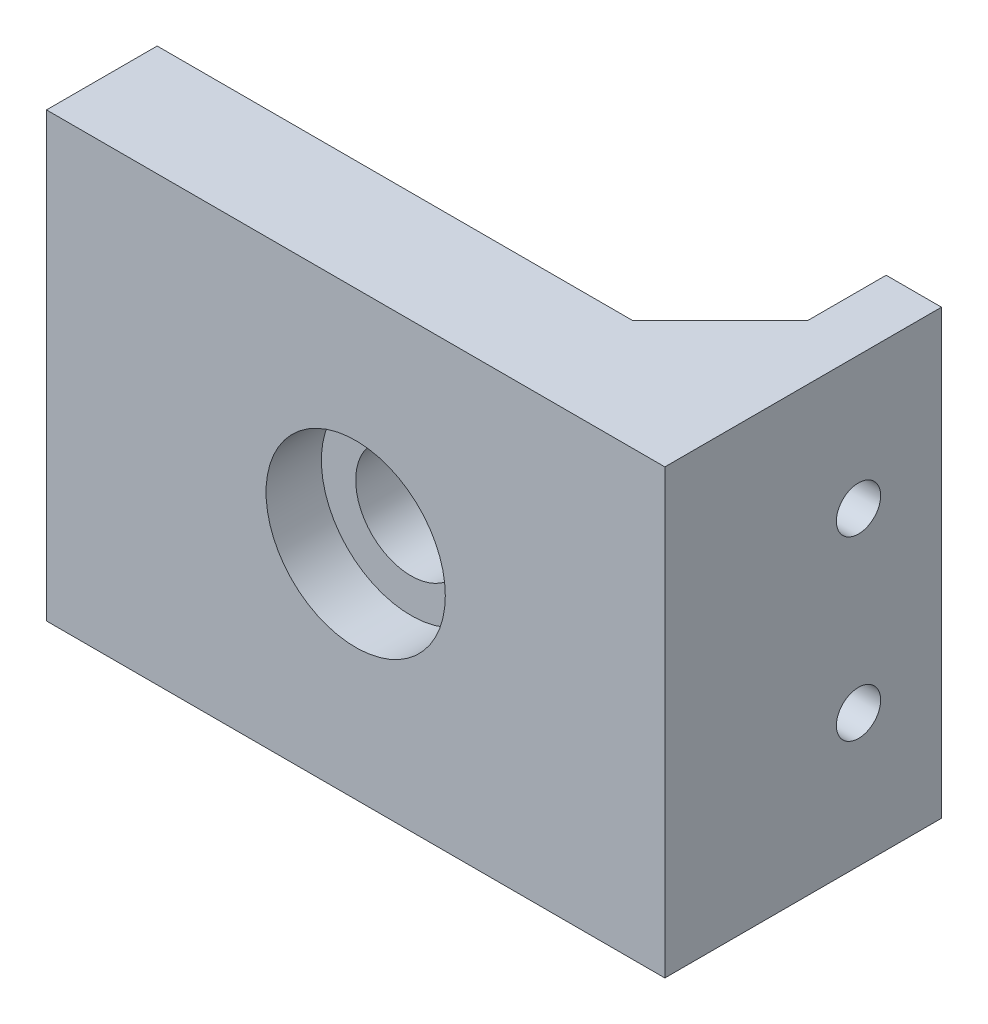
from build123d import *

# Parameters (mm, degrees)
SKETCH1_W           = 55.88
SKETCH1_H           = 40
SKETCH1_R           = 5
BOSS_EXTRUDE1_DEPTH = 10
SKETCH2_R           = 8.1
CUT_EXTRUDE1_DEPTH  = 5
SKETCH3_W           = 5
SKETCH3_H           = 40
BOSS_EXTRUDE3_DEPTH = 15
RIB1_REACH          = 53.046
SKETCH4_WALL_W      = 115.312280144
SKETCH4_WALL_H      = 5
SKETCH5_R           = 2
CUT_EXTRUDE2_DEPTH  = 15


with BuildPart() as part:
    # Sketch1 → Boss-Extrude1 (new body)
    with BuildSketch(Plane.XY):
        Rectangle(SKETCH1_W, SKETCH1_H)
        Circle(SKETCH1_R, mode=Mode.SUBTRACT)
    extrude(amount=BOSS_EXTRUDE1_DEPTH)

    # Sketch2 → Cut-Extrude1 (cut)
    with BuildSketch(Plane.XY.offset(10)):
        Circle(SKETCH2_R)
    extrude(amount=-CUT_EXTRUDE1_DEPTH, mode=Mode.SUBTRACT)

    # Sketch3 → Boss-Extrude3 (add)
    with BuildSketch(Plane(origin=(0, 0, 0), x_dir=(-1, 0, 0), z_dir=(0, 0, -1))):
        with Locations((-25.44, 0)):
            Rectangle(SKETCH3_W, SKETCH3_H)
    extrude(amount=BOSS_EXTRUDE3_DEPTH)

    # Sketch4 wall → Rib1 (add, up to next)
    with BuildSketch(Plane(origin=(18.972682027, 20, -3.967317973), x_dir=(0.707106781187, 0, -0.707106781187), z_dir=(-0.707106781187, 0, -0.707106781187)), mode=Mode.PRIVATE) as rib1_sk1:
        with Locations((0, 2.5)):
            Rectangle(SKETCH4_WALL_W, SKETCH4_WALL_H)
    rib1_tool1 = extrude(rib1_sk1.sketch, amount=-RIB1_REACH, mode=Mode.PRIVATE) - part.part
    rib1 = rib1_tool1.solids().sort_by_distance((18.972682027, 20, -3.967317973))[0]
    add(rib1)

    # Mirror1: Rib1 across plane
    add(rib1.mirror(Plane.ZX))

    # Sketch5 → Cut-Extrude2 (cut)
    with BuildSketch(Plane.ZY.offset(-22.94)):
        with Locations(Location((-7.5, 8, 0), (0, 0, 270))):
            Circle(SKETCH5_R)
        with Locations((-7.5, -8)):
            Circle(SKETCH5_R)
    extrude(amount=-CUT_EXTRUDE2_DEPTH, mode=Mode.SUBTRACT)


solid = part.part
